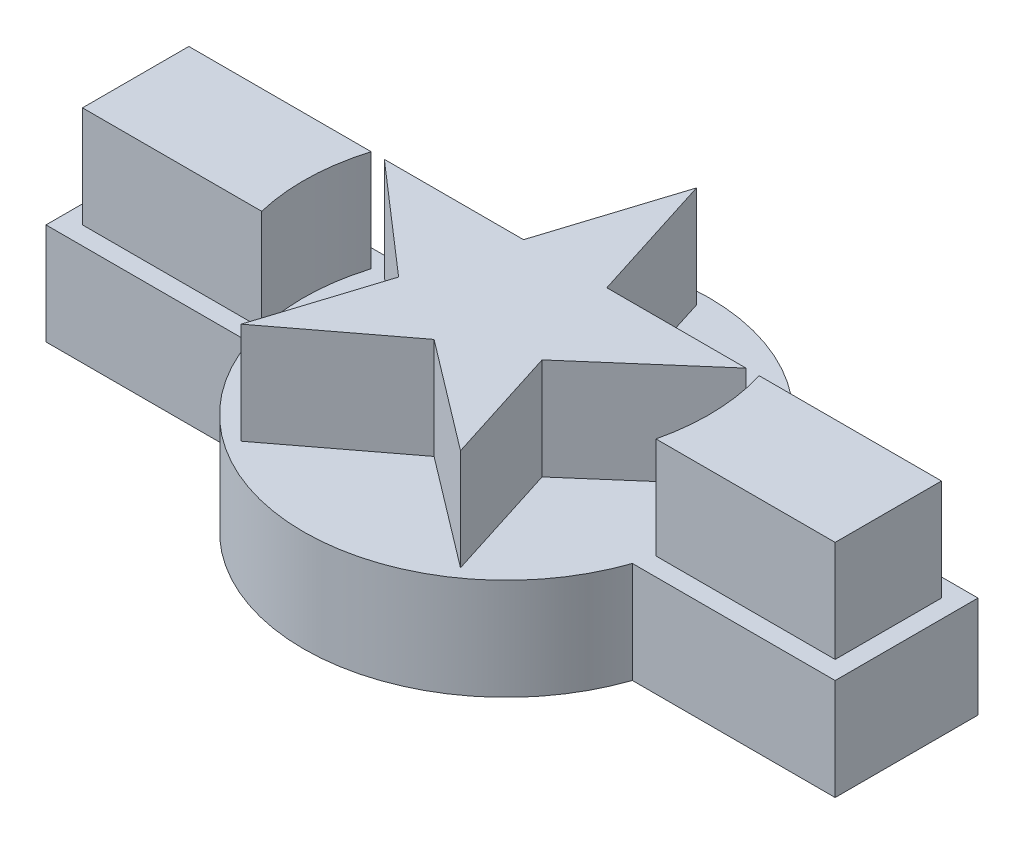
from build123d import *

# Parameters (mm, degrees)
BOSS_EXTRUDE1_DEPTH   = 5
BOSS_EXTRUDE1_2_DEPTH = 5
BOSS_EXTRUDE2_DEPTH   = 2.5


with BuildPart() as part:
    # Sketch3 → Boss-Extrude1 (new body)
    with BuildSketch(Plane(origin=(0, 0, 0), x_dir=(1, 0, 0), z_dir=(0, 1, 0))):
        with BuildLine():
            Line((9.280338467, 1.452751925), (4.784298469, 1.452751925))
            ThreePointArc((4.784298469, 1.452751925), (4.997850706, 0.146588935), (4.861220275, -1.16984505))
            Line((4.861220275, -1.16984505), (9.280338467, -1.16984505))
            Line((9.280338467, -1.16984505), (9.280338467, 1.452751925))
        make_face()
    extrude(amount=BOSS_EXTRUDE1_DEPTH)



with BuildPart() as body_2:
    # Sketch3 → Boss-Extrude1 2 (new body)
    with BuildSketch(Plane(origin=(0, 0, 0), x_dir=(1, 0, 0), z_dir=(0, 1, 0))):
        Polygon((1.026915579, 1.452751925), (0, 4.69), (0, -1.780366005), (2.703467563, -3.832409573), (1.768831042, -0.886061948), (4.459328632, 1.452751925), align=None)
    extrude(amount=BOSS_EXTRUDE1_2_DEPTH)


with BuildPart() as part_1:
    add(part.part)

    add(body_2.part)  # Boss-Extrude2 merges body 2
    # Sketch3<3> → Boss-Extrude2 (add)
    with BuildSketch(Plane(origin=(0, 0, 0), x_dir=(1, 0, 0), z_dir=(0, 1, 0))):
        with BuildLine():
            Line((9.730338467, -1.61984505), (9.730338467, 1.902751925))
            Line((9.730338467, 1.902751925), (4.623800938, 1.902751925))
            ThreePointArc((4.623800938, 1.902751925), (2.782646256, 4.154140081), (0, 5))
            Line((0, 5), (0, 4.69))
            Line((0, 4.69), (1.026915579, 1.452751925))
            Line((1.026915579, 1.452751925), (4.459328632, 1.452751925))
            Line((4.459328632, 1.452751925), (1.768831042, -0.886061948))
            Line((1.768831042, -0.886061948), (2.703467563, -3.832409573))
            Line((2.703467563, -3.832409573), (0, -1.780366005))
            Line((0, -1.780366005), (0, -5))
            ThreePointArc((0, -5), (2.906955, -4.068121511), (4.730338467, -1.61984505))
            Line((4.730338467, -1.61984505), (9.730338467, -1.61984505))
        make_face()
        with BuildLine():
            Line((9.280338467, -1.16984505), (4.861220275, -1.16984505))
            ThreePointArc((4.861220275, -1.16984505), (4.997850706, 0.146588935), (4.784298469, 1.452751925))
            Line((4.784298469, 1.452751925), (9.280338467, 1.452751925))
            Line((9.280338467, 1.452751925), (9.280338467, -1.16984505))
        make_face(mode=Mode.SUBTRACT)
    extrude(amount=BOSS_EXTRUDE2_DEPTH)

    # Mirror1: part across plane


with BuildPart() as part_2:
    add(part_1.part)
    add(part_1.part.mirror(Plane(origin=(0, 0, 0), x_dir=(0, 0, 1), z_dir=(1, 0, 0))))


solid = part_2.part
